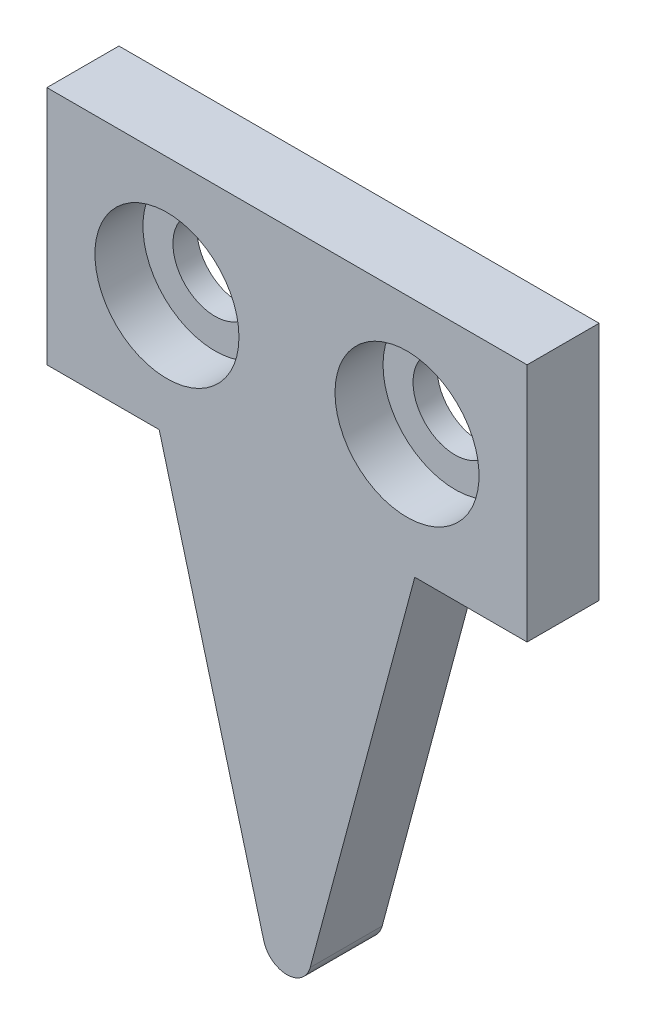
from build123d import *

# Parameters (mm, degrees)
BOSS_EXTRUDE1_DEPTH = 3
SKETCH3_R           = 1.75
CUT_EXTRUDE1_DEPTH  = 3
SKETCH5_R           = 3
CUT_EXTRUDE2_DEPTH  = 2


with BuildPart() as part:
    # Sketch2 → Boss-Extrude1 (new body)
    with BuildSketch(Plane.XY):
        with BuildLine():
            Line((-5.322463259, 16), (-0.965925826, -0.258819045))
            ThreePointArc((-0.965925826, -0.258819045), (0, -1), (0.965925826, -0.258819045))
            Line((0.965925826, -0.258819045), (5.322463259, 16))
            Line((5.322463259, 16), (10, 16))
            Line((10, 16), (10, 26))
            Line((10, 26), (-10, 26))
            Line((-10, 26), (-10, 16))
            Line((-10, 16), (-5.322463259, 16))
        make_face()
    extrude(amount=BOSS_EXTRUDE1_DEPTH)

    # Sketch3 → Cut-Extrude1 (cut)
    with BuildSketch(Plane.XY.offset(3)):
        with Locations((-5, 21)):
            Circle(SKETCH3_R)
        with Locations((5, 21)):
            Circle(SKETCH3_R)
    extrude(amount=-CUT_EXTRUDE1_DEPTH, mode=Mode.SUBTRACT)

    # Sketch5 → Cut-Extrude2 (cut)
    with BuildSketch(Plane.XY.offset(3)):
        with Locations((-5, 21)):
            Circle(SKETCH5_R)
        with Locations(Location((5, 21, 0), (0, 0, 180))):
            Circle(SKETCH5_R)
    extrude(amount=-CUT_EXTRUDE2_DEPTH, mode=Mode.SUBTRACT)


solid = part.part
